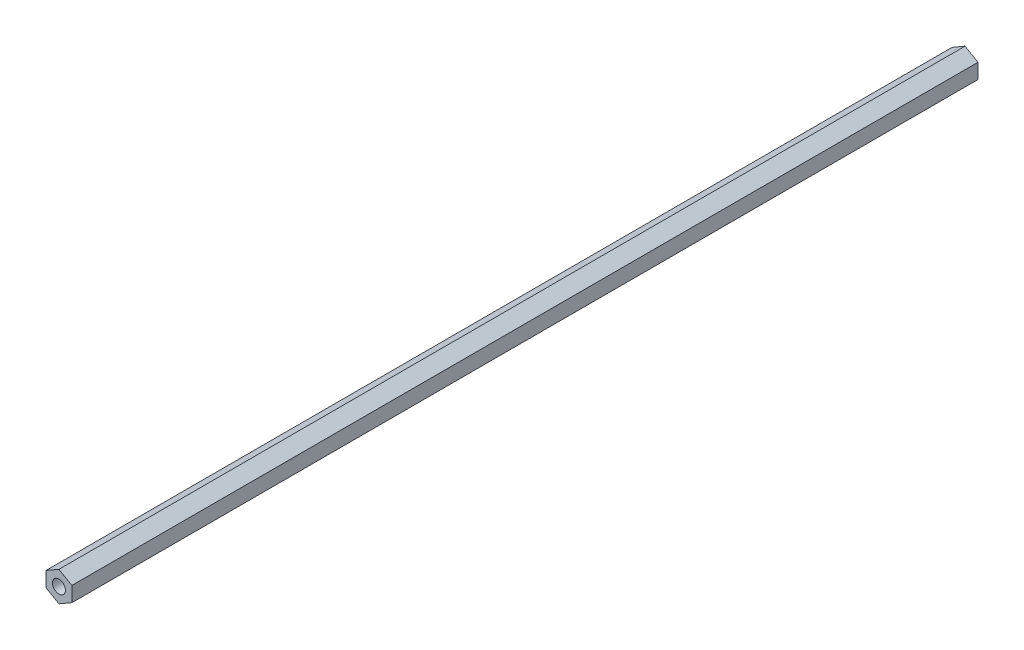
from build123d import *

# Parameters (mm, degrees)
BOSS_EXTRUDE2_DEPTH             = 222.249999
BOSS_EXTRUDE2_DEPTH_BACK        = 222.249999
F_1_4_0_25_DIAMETER_HOLE1_D     = 6.35
F_1_4_0_25_DIAMETER_HOLE1_DEPTH = 25.4
F_1_4_0_25_DIAMETER_HOLE1_TIP   = 1.907732465
F_1_4_0_25_DIAMETER_HOLE2_D     = 6.35
F_1_4_0_25_DIAMETER_HOLE2_DEPTH = 25.4
F_1_4_0_25_DIAMETER_HOLE2_TIP   = 1.907732465


with BuildPart() as part:
    # Sketch3 → Boss-Extrude2 (new, two sides: drawn at the far end of the back side and taken through both)
    with BuildSketch(Plane.XY.offset(-BOSS_EXTRUDE2_DEPTH_BACK)):
        Polygon((-6.35, -3.666174209), (0, -7.332348419), (6.35, -3.666174209), (6.35, 3.666174209), (0, 7.332348419), (-6.35, 3.666174209), align=None)
    extrude(amount=BOSS_EXTRUDE2_DEPTH + BOSS_EXTRUDE2_DEPTH_BACK)

    # 1/4 (0.25) Diameter Hole1
    with Locations(Plane.XY.offset(222.249999492)):
        with Locations((0, 0)):
            Hole(F_1_4_0_25_DIAMETER_HOLE1_D / 2, depth=F_1_4_0_25_DIAMETER_HOLE1_DEPTH)
            with Locations((0, 0, -(F_1_4_0_25_DIAMETER_HOLE1_DEPTH + F_1_4_0_25_DIAMETER_HOLE1_TIP / 2))):  # 118° drill point
                Cone(0, F_1_4_0_25_DIAMETER_HOLE1_D / 2, F_1_4_0_25_DIAMETER_HOLE1_TIP, mode=Mode.SUBTRACT)

    # 1/4 (0.25) Diameter Hole2
    with Locations(Plane(origin=(0, 0, -222.249999492), x_dir=(-1, 0, 0), z_dir=(0, 0, -1))):
        with Locations((0, 0)):
            Hole(F_1_4_0_25_DIAMETER_HOLE2_D / 2, depth=F_1_4_0_25_DIAMETER_HOLE2_DEPTH)
            with Locations((0, 0, -(F_1_4_0_25_DIAMETER_HOLE2_DEPTH + F_1_4_0_25_DIAMETER_HOLE2_TIP / 2))):  # 118° drill point
                Cone(0, F_1_4_0_25_DIAMETER_HOLE2_D / 2, F_1_4_0_25_DIAMETER_HOLE2_TIP, mode=Mode.SUBTRACT)


solid = part.part
